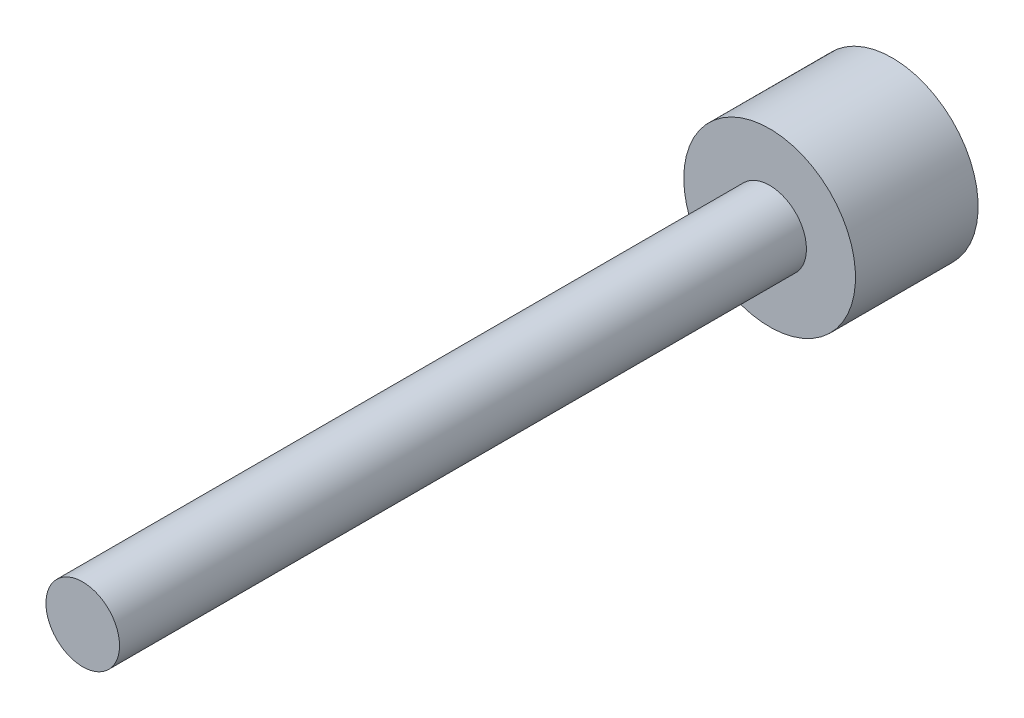
from build123d import *

# Parameters (mm, degrees)
ESQUISSE1_R        = 1.5
BOSS_EXTRU_1_DEPTH = 28
ESQUISSE2_R        = 3.5
BOSS_EXTRU_2_DEPTH = 5


with BuildPart() as part:
    # Esquisse1 → Boss.-Extru.1 (new body)
    with BuildSketch(Plane.XY):
        Circle(ESQUISSE1_R)
    extrude(amount=BOSS_EXTRU_1_DEPTH)

    # Esquisse2 → Boss.-Extru.2 (add)
    with BuildSketch(Plane(origin=(0, 0, 0), x_dir=(-1, 0, 0), z_dir=(0, 0, -1))):
        Circle(ESQUISSE2_R)
    extrude(amount=BOSS_EXTRU_2_DEPTH)


solid = part.part
